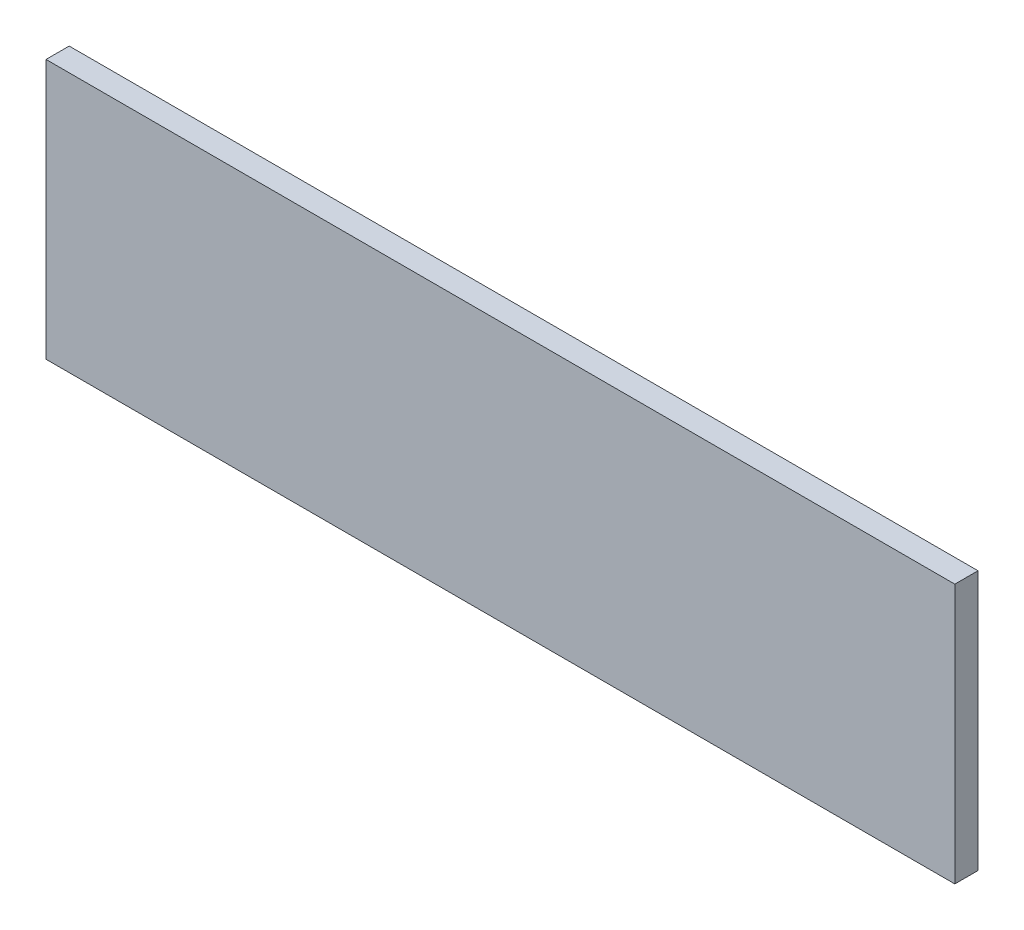
from build123d import *

# Parameters (mm, degrees)
SKETCH1_W           = 71.12
SKETCH1_H           = 6.35
BOSS_EXTRUDE1_DEPTH = 248.92


with BuildPart() as part:
    # Sketch1 → Boss-Extrude1 (new body)
    with BuildSketch(Plane.YZ):
        with Locations((35.56, 3.175)):
            Rectangle(SKETCH1_W, SKETCH1_H)
    extrude(amount=BOSS_EXTRUDE1_DEPTH)


solid = part.part
